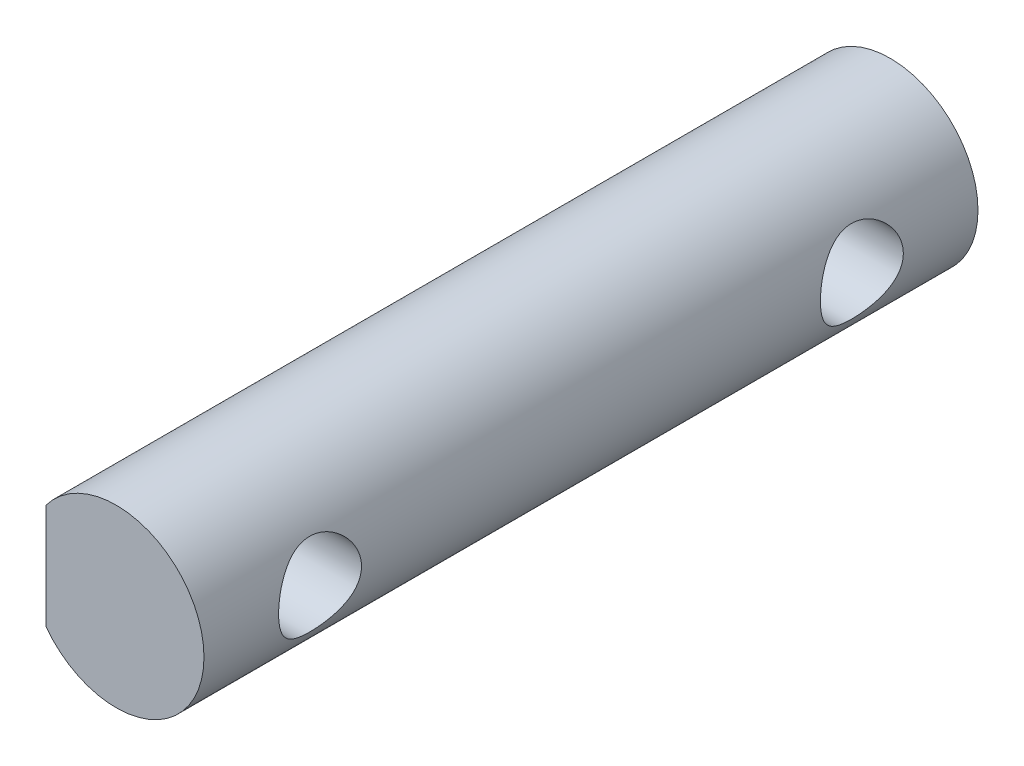
from build123d import *

# Parameters (mm, degrees)
BOSS_EXTRUDE1_DEPTH     = 28
CUT_EXTRUDE1_REACH      = 30.753
CUT_EXTRUDE1_END_RADIUS = 3.175
SKETCH3_R               = 1.5


with BuildPart() as part:
    # Sketch1 → Boss-Extrude1 (new body)
    with BuildSketch(Plane.XY):
        with BuildLine():
            Line((-2.54, 1.905), (-2.54, -1.905))
            ThreePointArc((-2.54, -1.905), (3.175, 0), (-2.54, 1.905))
        make_face()
    extrude(amount=BOSS_EXTRUDE1_DEPTH)

    # Cut-Extrude1: up to this cylinder (the profile starts inside it)
    cut_extrude1_end = Plane(origin=(0, 0, 14), z_dir=(0, 0, -1)) * Cylinder(CUT_EXTRUDE1_END_RADIUS, 88.456, mode=Mode.PRIVATE)
    # Sketch3 → Cut-Extrude1 (cut, up to the surface)
    with BuildSketch(Plane.ZY.offset(2.54), mode=Mode.PRIVATE) as cut_extrude1_sk1:
        with Locations((4.2, 0)):
            Circle(SKETCH3_R)
    cut_extrude1_tool1 = extrude(cut_extrude1_sk1.sketch, amount=-CUT_EXTRUDE1_REACH, mode=Mode.PRIVATE) & cut_extrude1_end
    add(cut_extrude1_tool1.solids().sort_by_distance((-2.54, 0, 4.2))[0], mode=Mode.SUBTRACT)
    # Sketch3 → Cut-Extrude1 (cut, up to the surface)
    with BuildSketch(Plane.ZY.offset(2.54), mode=Mode.PRIVATE) as cut_extrude1_sk2:
        with Locations((23.8, 0)):
            Circle(SKETCH3_R)
    cut_extrude1_tool2 = extrude(cut_extrude1_sk2.sketch, amount=-CUT_EXTRUDE1_REACH, mode=Mode.PRIVATE) & cut_extrude1_end
    add(cut_extrude1_tool2.solids().sort_by_distance((-2.54, 0, 23.8))[0], mode=Mode.SUBTRACT)


solid = part.part
